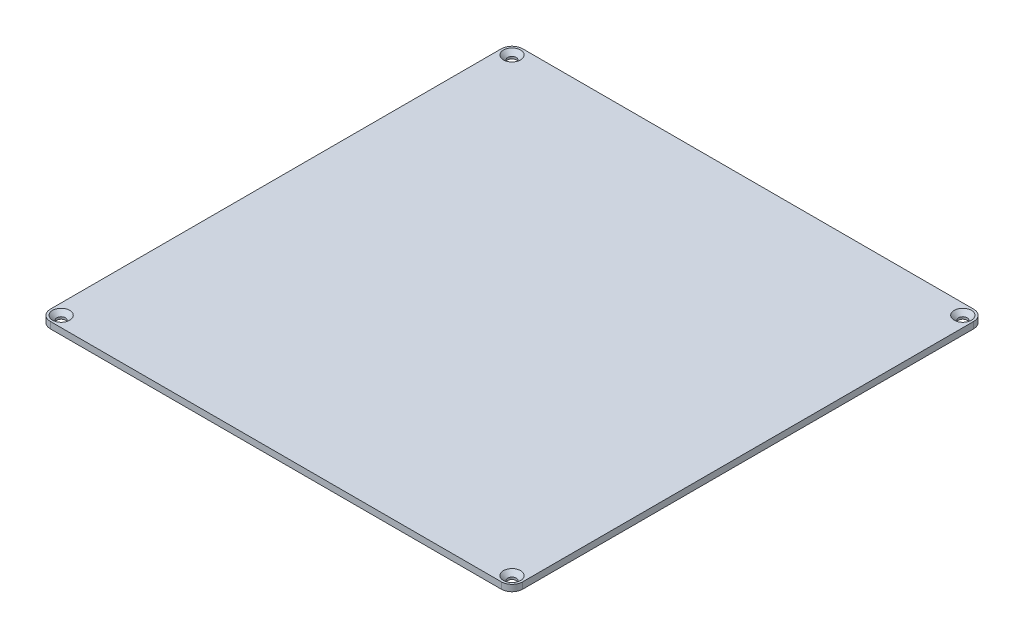
from build123d import *

# Parameters (mm, degrees)
SKETCH1_W           = 220
SKETCH1_H           = 220
BOSS_EXTRUDE1_DEPTH = 3
FILLET1_R           = 5
SKETCH2_R           = 2
CUT_EXTRUDE1_DEPTH  = 3
CHAMFER1_SIZE       = 2


with BuildPart() as part:
    # Sketch1 → Boss-Extrude1 (new body)
    with BuildSketch(Plane(origin=(0, 0, 0), x_dir=(1, 0, 0), z_dir=(0, 1, 0))):
        with Locations((-110, 110)):
            Rectangle(SKETCH1_W, SKETCH1_H)
    extrude(amount=BOSS_EXTRUDE1_DEPTH)

    # Fillet1
    fillet1_edges = [part.edges().sort_by_distance(p)[0] for p in [
        (0, 1.5, 0),
        (-220, 1.5, 0),
        (-220, 1.5, -220),
        (0, 1.5, -220),
    ]]
    fillet(fillet1_edges, radius=FILLET1_R)

    # Sketch2 → Cut-Extrude1 (cut)
    with BuildSketch(Plane(origin=(0, 3, 0), x_dir=(1, 0, 0), z_dir=(0, 1, 0))):
        with Locations(Location((-215, 215, 0), (0, 0, 270))):
            Circle(SKETCH2_R)
        with Locations(Location((-215, 5, 0), (0, 0, 270))):
            Circle(SKETCH2_R)
        with Locations(Location((-5, 5, 0), (0, 0, 90))):
            Circle(SKETCH2_R)
        with Locations(Location((-5, 215, 0), (0, 0, 90))):
            Circle(SKETCH2_R)
    extrude(amount=-CUT_EXTRUDE1_DEPTH, mode=Mode.SUBTRACT)

    # Chamfer1
    chamfer1_edges = [part.edges().sort_by_distance(p)[0] for p in [
        (-5, 3, -213),
        (-5, 3, -3),
        (-215, 3, -7),
        (-215, 3, -217),
    ]]
    chamfer(chamfer1_edges, length=CHAMFER1_SIZE)


solid = part.part
